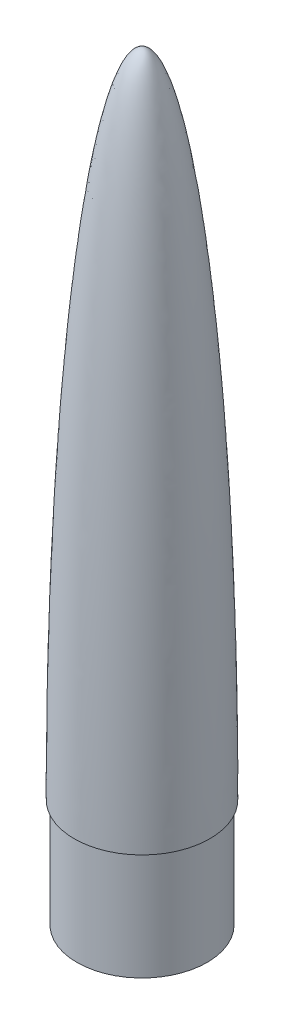
from build123d import *

# Parameters (mm, degrees)
BOTTOMLOCKINGBODYS_W = 2.5
BOTTOMLOCKINGBODYS_H = 20


with BuildPart() as part:
    # TopBodyS → TopBody (revolve)
    with BuildSketch(Plane.XY):
        with BuildLine():
            Line((-12.5, 0), (-9.5, 0))
            add(Edge.make_bspline(
                [(0, 117), (-9.5, 117), (-9.5, 0)],
                knots=[0, 0, 0, 1.570796327, 1.570796327, 1.570796327], degree=2, weights=[1, 0.707106781, 1]))
            Line((0, 117), (0, 120))
            add(Edge.make_bspline(
                [(0, 120), (-12.5, 120), (-12.5, 0)],
                knots=[0, 0, 0, 1.570796327, 1.570796327, 1.570796327], degree=2, weights=[1, 0.707106781, 1]))
        make_face()
    revolve(axis=Axis((0, 0, 0), (0, 1, 0)))

    # BottomLockingBodyS → BottomLockingBody (revolve)
    with BuildSketch(Plane.XY):
        with Locations((-10.75, -10)):
            Rectangle(BOTTOMLOCKINGBODYS_W, BOTTOMLOCKINGBODYS_H)
    revolve(axis=Axis((0, 127, 0), (0, -1, 0)))


solid = part.part
